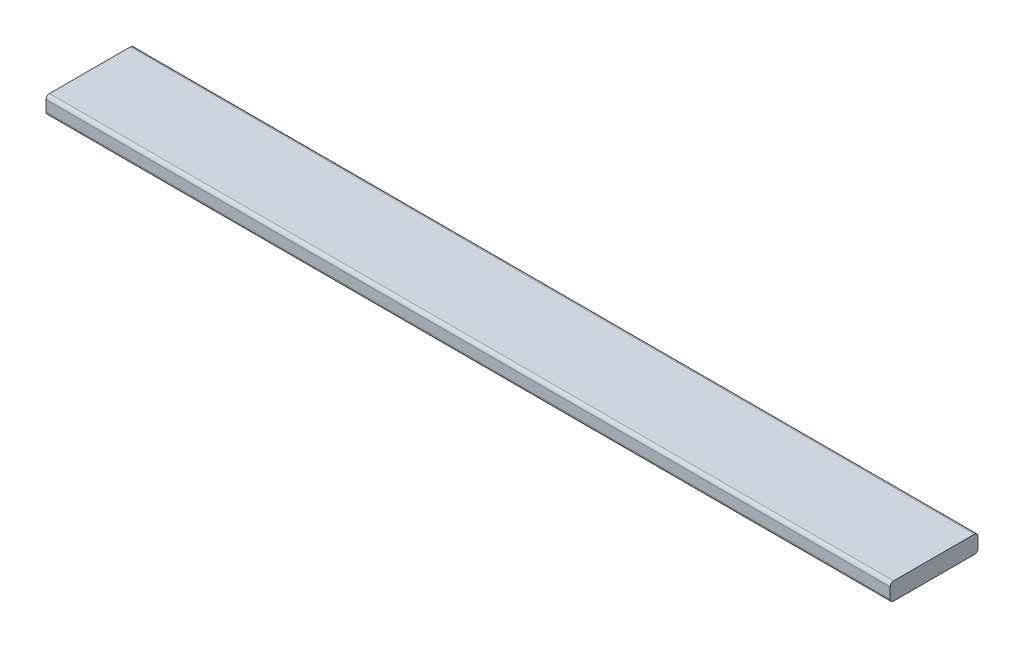
from build123d import *

# Parameters (mm, degrees)
SKETCH1_W           = 304.8
SKETCH1_H           = 31.75
BOSS_EXTRUDE1_DEPTH = 6.35
FILLET1_R           = 1.27


with BuildPart() as part:
    # Sketch1 → Boss-Extrude1 (new body)
    with BuildSketch(Plane(origin=(0, 0, 0), x_dir=(1, 0, 0), z_dir=(0, 1, 0))):
        Rectangle(SKETCH1_W, SKETCH1_H)
    extrude(amount=BOSS_EXTRUDE1_DEPTH)

    # Fillet1
    fillet1_edges = [part.edges().sort_by_distance(p)[0] for p in [
        (0, 6.35, -15.875),
        (0, 0, -15.875),
        (0, 0, 15.875),
        (0, 6.35, 15.875),
    ]]
    fillet(fillet1_edges, radius=FILLET1_R)


solid = part.part
